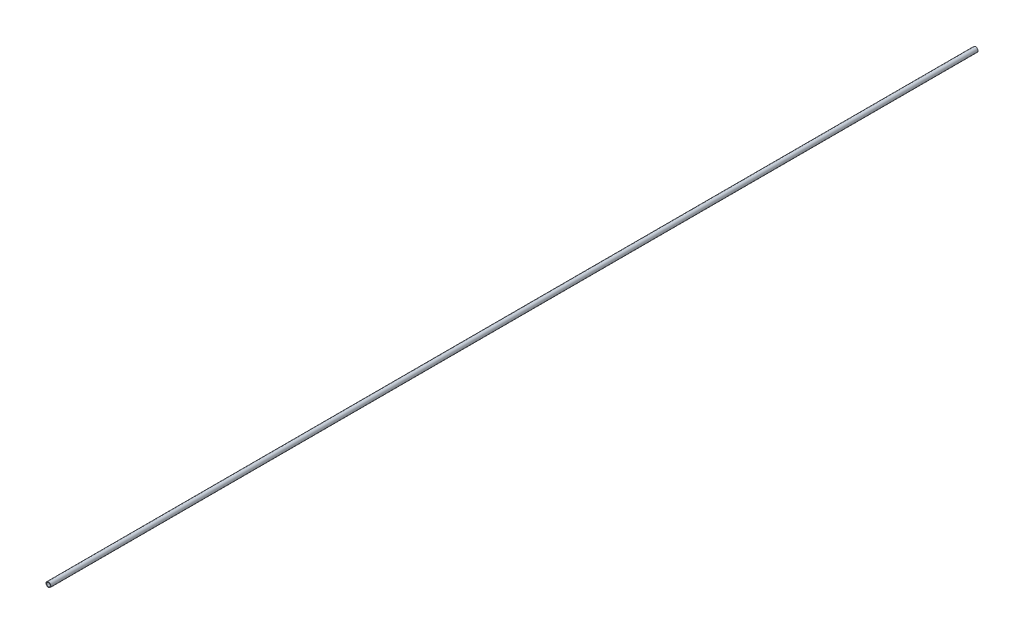
from build123d import *

# Parameters (mm, degrees)
SKETCH3_R           = 2.38125
SKETCH3_R_2         = 1.8288
BOSS_EXTRUDE1_DEPTH = 457.2


with BuildPart() as part:
    # Sketch3 → Boss-Extrude1 (new, symmetric)
    with BuildSketch(Plane.XY):
        Circle(SKETCH3_R)
        Circle(SKETCH3_R_2, mode=Mode.SUBTRACT)
    extrude(amount=BOSS_EXTRUDE1_DEPTH, both=True)


solid = part.part
